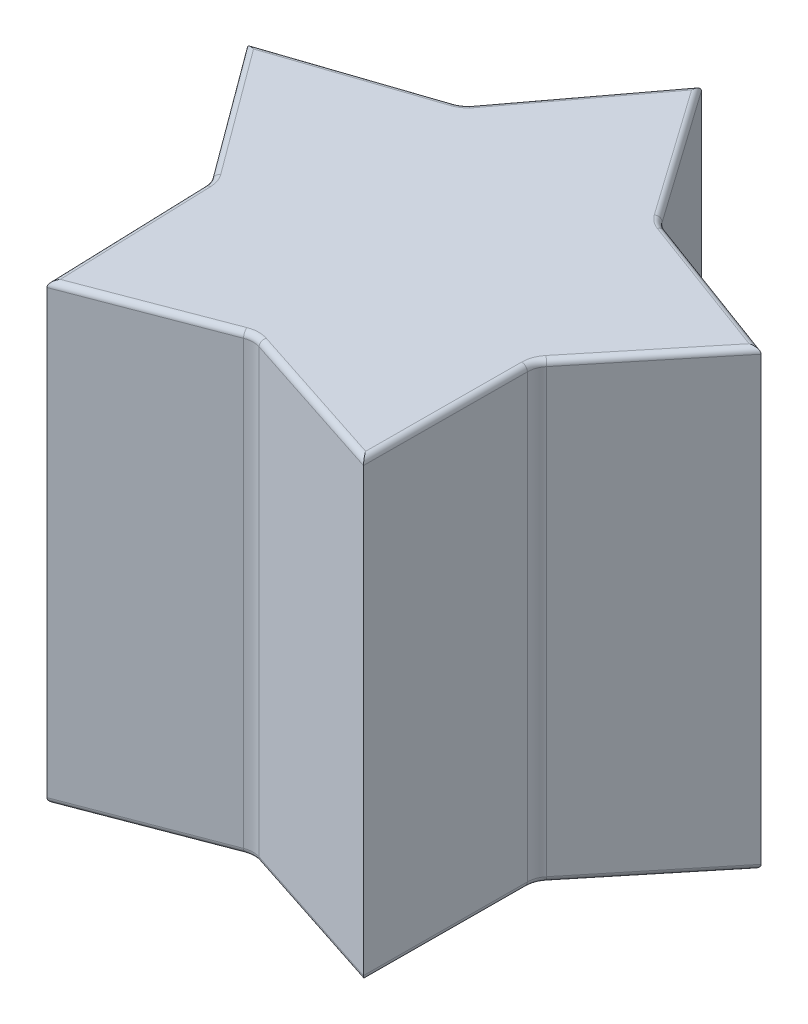
from build123d import *

# Parameters (mm, degrees)
BOSS_EXTRUDE1_DEPTH = 40
FILLET1_R           = 0.5


with BuildPart() as part:
    # Sketch1 → Boss-Extrude1 (new body)
    with BuildSketch(Plane(origin=(0, 0, 0), x_dir=(-1, 0, 0), z_dir=(0, 1, 0))):
        with BuildLine():
            Line((-16.382358243, -12.416132382), (-16.309116245, 1.980717277))
            Line((-16.309116245, 1.980717277), (-2.623220974, -2.488165706))
            ThreePointArc((-2.623220974, -2.488165706), (-1.953288331, -2.586352132), (-1.288986221, -2.455382561))
            Line((-1.288986221, -2.455382561), (11.279166812, 2.343564434))
            Line((11.279166812, 2.343564434), (11.764255017, -12.063312843))
            ThreePointArc((11.764255017, -12.063312843), (11.874027832, -12.652761031), (12.15358265, -13.183183826))
            Line((12.15358265, -13.183183826), (20.699476347, -24.769483728))
            Line((20.699476347, -24.769483728), (7.033191834, -29.354905309))
            ThreePointArc((7.033191834, -29.354905309), (6.499122182, -29.629147424), (6.070505236, -30.049536105))
            Line((6.070505236, -30.049536105), (-2.58921338, -41.573541353))
            Line((-2.58921338, -41.573541353), (-10.890805488, -29.810964554))
            ThreePointArc((-10.890805488, -29.810964554), (-11.306058502, -29.378455396), (-11.830848647, -29.088464807))
            Line((-11.830848647, -29.088464807), (-25.350255054, -24.086557786))
            Line((-25.350255054, -24.086557786), (-16.834067363, -13.67200498))
            ThreePointArc((-16.834067363, -13.67200498), (-16.500364189, -13.082859401), (-16.382358243, -12.416132382))
        make_face()
    extrude(amount=BOSS_EXTRUDE1_DEPTH)

    # Fillet1
    fillet1_edges = [part.edges().sort_by_distance(p)[0] for p in [
        (18.59055185, 40, -26.587511297),
        (16.345737244, 0, -5.217707553),
        (9.46616861, 0, -0.253724215),
        (1.953288331, 0, -2.586352132),
        (-4.995090296, 0, -0.055909063),
        (-11.521710915, 0, -4.859874204),
        (-11.874027832, 0, -12.652761031),
        (11.306058502, 40, -29.378455396),
        (-16.426529498, 0, -18.976333777),
        (-13.86633409, 0, -27.062194519),
        (-6.499122182, 0, -29.629147424),
        (-1.740645928, 0, -35.811538729),
        (6.740009434, 0, -35.692252953),
        (11.306058502, 0, -29.378455396),
        (18.59055185, 0, -26.587511297),
        (21.092161209, 0, -18.879281383),
        (16.500364189, 0, -13.082859401),
        (6.740009434, 40, -35.692252953),
        (-1.740645928, 40, -35.811538729),
        (-6.499122182, 40, -29.629147424),
        (-13.86633409, 40, -27.062194519),
        (-16.426529498, 40, -18.976333777),
        (-11.874027832, 40, -12.652761031),
        (-11.521710915, 40, -4.859874204),
        (-4.995090296, 40, -0.055909063),
        (16.500364189, 40, -13.082859401),
        (1.953288331, 40, -2.586352132),
        (9.46616861, 40, -0.253724215),
        (16.345737244, 40, -5.217707553),
        (21.092161209, 40, -18.879281383),
    ]]
    fillet(fillet1_edges, radius=FILLET1_R)


solid = part.part
